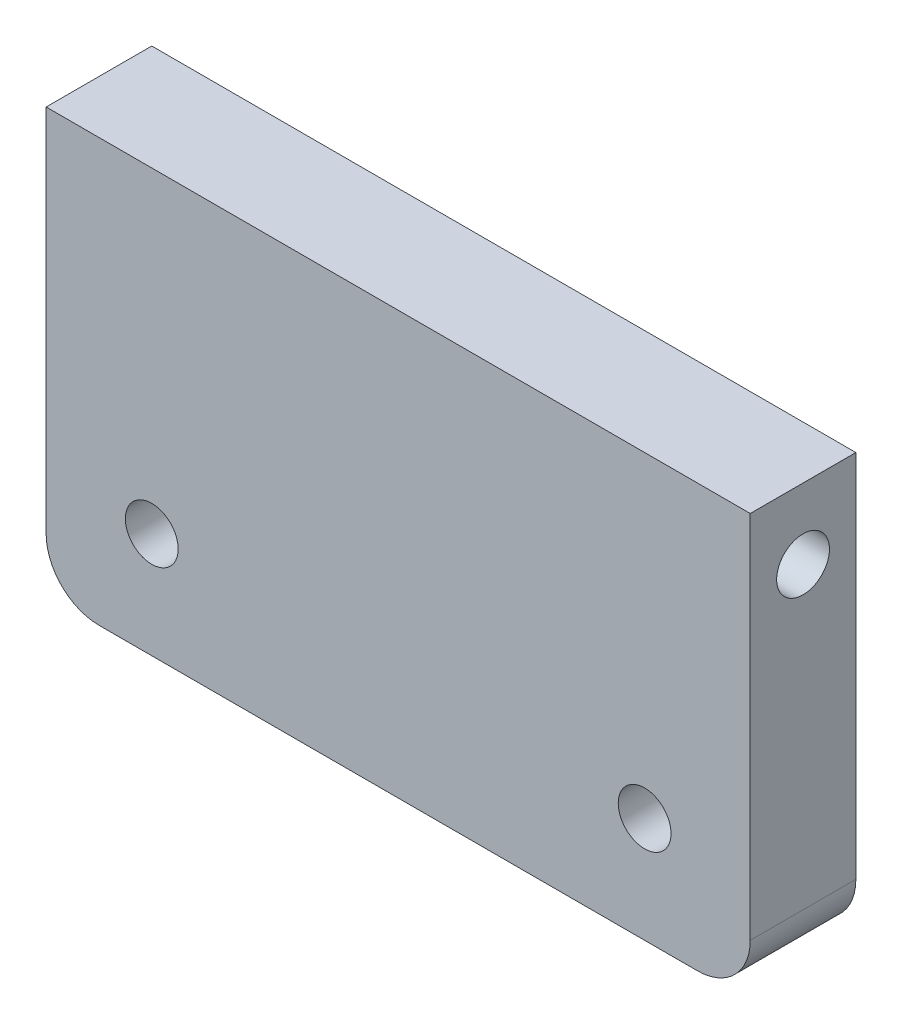
from build123d import *

# Parameters (mm, degrees)
SKETCH2_R           = 4.7625
BOSS_EXTRUDE1_DEPTH = 19.05
SKETCH3_R           = 4.7625
CUT_EXTRUDE1_DEPTH  = 139.7


with BuildPart() as part:
    # Sketch2 → Boss-Extrude1 (new body)
    with BuildSketch(Plane.XY):
        with BuildLine():
            Line((-63.5, 38.1), (63.5, 38.1))
            Line((63.5, 38.1), (63.5, -28.575))
            ThreePointArc((63.5, -28.575), (60.710192091, -35.310192091), (53.975, -38.1))
            Line((53.975, -38.1), (-53.975, -38.1))
            ThreePointArc((-53.975, -38.1), (-60.710192091, -35.310192091), (-63.5, -28.575))
            Line((-63.5, -28.575), (-63.5, 38.1))
        make_face()
        with Locations(Location((-44.45, -19.05, 0), (0, 0, 180))):
            Circle(SKETCH2_R, mode=Mode.SUBTRACT)
        with Locations(Location((44.45, -19.05, 0), (0, 0, 180))):
            Circle(SKETCH2_R, mode=Mode.SUBTRACT)
    extrude(amount=BOSS_EXTRUDE1_DEPTH)

    # Sketch3 → Cut-Extrude1 (cut)
    with BuildSketch(Plane(origin=(63.5, 0, 0), x_dir=(0, 0, -1), z_dir=(1, 0, 0))):
        with Locations((-9.525, 25.4)):
            Circle(SKETCH3_R)
    extrude(amount=-CUT_EXTRUDE1_DEPTH, mode=Mode.SUBTRACT)


solid = part.part
